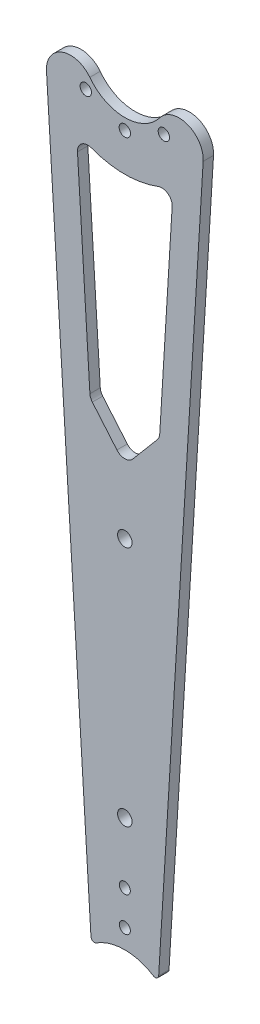
from build123d import *

# Parameters (mm, degrees)
SKETCH_1_R          = 1.65
EXTRUDE_1_DEPTH     = 3
SKETCH_2_R          = 1.6
CUT_EXTRUDE_1_DEPTH = 15
CUT_EXTRUDE_2_DEPTH = 15
SKETCH_5_R          = 2.1
CUT_EXTRUDE_4_DEPTH = 10
EXTRUDE_2_DEPTH     = 3


with BuildPart() as part:
    # 草图1 → 凸台-拉伸1 (new body)
    with BuildSketch(Plane.XY):
        with BuildLine():
            Line((-10, -220), (10, -220))
            Line((10, -220), (22.697635701, -12.395491404))
            ThreePointArc((22.697635701, -12.395491404), (18.150671537, -5.407168438), (10.142345541, -7.726275101))
            ThreePointArc((10.142345541, -7.726275101), (0, -12.75), (-10.142345541, -7.726275101))
            ThreePointArc((-10.142345541, -7.726275101), (-18.150671537, -5.407168438), (-22.697635701, -12.395491404))
            Line((-22.697635701, -12.395491404), (-10, -220))
        make_face()
        with Locations((-11.313708499, -11.313708499)):
            Circle(SKETCH_1_R, mode=Mode.SUBTRACT)
        with Locations((0, -16)):
            Circle(SKETCH_1_R, mode=Mode.SUBTRACT)
        with Locations((11.313708499, -11.313708499)):
            Circle(SKETCH_1_R, mode=Mode.SUBTRACT)
    extrude(amount=EXTRUDE_1_DEPTH)

    # 草图2 → 切除-拉伸1 (cut)
    with BuildSketch(Plane.XY.offset(3)):
        with Locations((0, -216)):
            Circle(SKETCH_2_R)
        with Locations((0, -206)):
            Circle(SKETCH_2_R)
    extrude(amount=-CUT_EXTRUDE_1_DEPTH, mode=Mode.SUBTRACT)

    # 草图4 → 切除-拉伸2 (cut)
    with BuildSketch(Plane(origin=(0, 0, 0), x_dir=(-1, 0, 0), z_dir=(0, 0, -1))):
        with BuildLine():
            Line((-13.715926625, -28.201870805), (-10.113702702, -87.097711346))
            ThreePointArc((-10.113702702, -87.097711346), (-9.904103863, -88.030297779), (-9.411801117, -88.849618921))
            Line((-9.411801117, -88.849618921), (-2.292502811, -97.284018261))
            ThreePointArc((-2.292502811, -97.284018261), (0, -98.348965067), (2.292502811, -97.284018261))
            Line((2.292502811, -97.284018261), (9.411801117, -88.849618921))
            ThreePointArc((9.411801117, -88.849618921), (9.904103863, -88.030297779), (10.113702702, -87.097711346))
            Line((10.113702702, -87.097711346), (13.715926625, -28.201870805))
            ThreePointArc((13.715926625, -28.201870805), (12.496725506, -25.600326268), (9.649370007, -25.216852668))
            ThreePointArc((9.649370007, -25.216852668), (0, -27), (-9.649370007, -25.216852668))
            ThreePointArc((-9.649370007, -25.216852668), (-12.496725506, -25.600326268), (-13.715926625, -28.201870805))
        make_face()
    extrude(amount=-CUT_EXTRUDE_2_DEPTH, mode=Mode.SUBTRACT)

    # 草图5 → 切除-拉伸4 (cut)
    with BuildSketch(Plane.XY.offset(3)):
        with Locations((0, -188.402692504)):
            Circle(SKETCH_5_R)
        with Locations((0, -118.402692504)):
            Circle(SKETCH_5_R)
    extrude(amount=-CUT_EXTRUDE_4_DEPTH, mode=Mode.SUBTRACT)

    # 草图3 → 凸台-拉伸2 (add)
    with BuildSketch(Plane.XY.offset(3)):
        with BuildLine():
            Line((10, -220), (0, -220))
            Line((0, -220), (0, -221.563277065))
            ThreePointArc((0, -221.563277065), (4.306596315, -222.17357498), (8.274056276, -223.956408914))
            ThreePointArc((8.274056276, -223.956408914), (9.263696736, -224.000871181), (9.806001156, -223.171853056))
            Line((9.806001156, -223.171853056), (10, -220))
        make_face()
        with BuildLine():
            Line((0, -220), (-10, -220))
            Line((-10, -220), (-9.806001156, -223.171853056))
            ThreePointArc((-9.806001156, -223.171853056), (-9.263696736, -224.000871181), (-8.274056276, -223.956408914))
            ThreePointArc((-8.274056276, -223.956408914), (-4.306596315, -222.17357498), (0, -221.563277065))
            Line((0, -221.563277065), (0, -220))
        make_face()
    extrude(amount=-EXTRUDE_2_DEPTH)


solid = part.part
